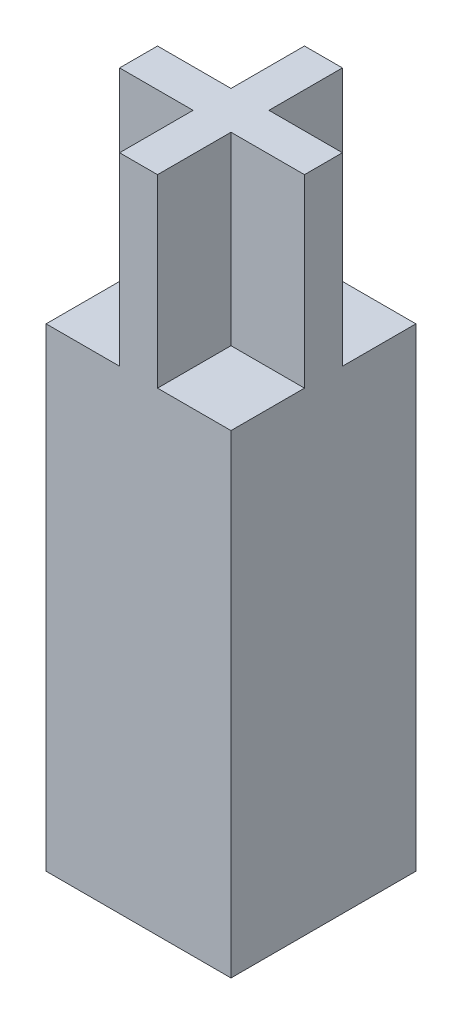
from build123d import *

# Parameters (mm, degrees)
SKETCH_5_W      = 0.8
SKETCH_5_H      = 3.9
SKETCH_5_W_2    = 3.9
SKETCH_5_H_2    = 0.8
EXTRUDE_1_DEPTH = 3.9
SKETCH_6_W      = 3.9
SKETCH_6_H      = 3.9
EXTRUDE_2_DEPTH = 10


with BuildPart() as part:
    # 草图5 → 凸台-拉伸1 (new body)
    with BuildSketch(Plane(origin=(0, 0, 0), x_dir=(-1, 0, 0), z_dir=(0, 1, 0))):
        Rectangle(SKETCH_5_W, SKETCH_5_H)
        Rectangle(SKETCH_5_W_2, SKETCH_5_H_2)
    extrude(amount=EXTRUDE_1_DEPTH)

    # 草图6 → 凸台-拉伸2 (add)
    with BuildSketch(Plane.XZ):
        Rectangle(SKETCH_6_W, SKETCH_6_H)
    extrude(amount=EXTRUDE_2_DEPTH)


solid = part.part
